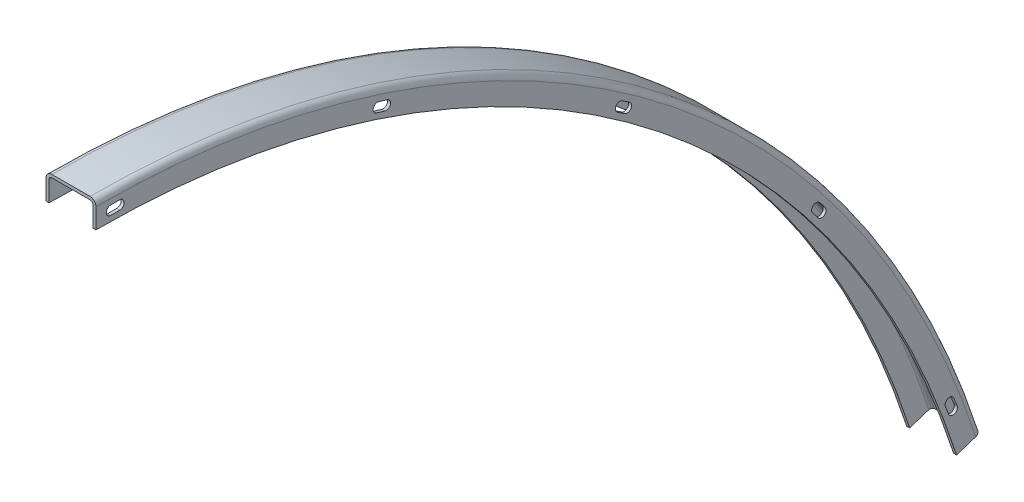
from build123d import *

# Parameters (mm, degrees)
REVOLVE1_ANGLE     = 72
CUT_EXTRUDE1_DEPTH = 10


with BuildPart() as part:
    # Sketch1 → Revolve1 (revolve)
    with BuildSketch(Plane.XY):
        with BuildLine():
            ThreePointArc((-52.157480315, 97.330708661), (-49.814334564, 102.987562911), (-44.157480315, 105.330708661))
            Line((-44.157480315, 105.330708661), (6.842519685, 105.330708661))
            ThreePointArc((6.842519685, 105.330708661), (12.499373935, 102.987562911), (14.842519685, 97.330708661))
            Line((14.842519685, 97.330708661), (14.842519685, 70.330708661))
            Line((14.842519685, 70.330708661), (10.842519685, 70.330708661))
            Line((10.842519685, 70.330708661), (10.842519685, 97.330708661))
            ThreePointArc((10.842519685, 97.330708661), (9.67094681, 100.159135786), (6.842519685, 101.330708661))
            Line((6.842519685, 101.330708661), (-44.157480315, 101.330708661))
            ThreePointArc((-44.157480315, 101.330708661), (-46.98590744, 100.159135786), (-48.157480315, 97.330708661))
            Line((-48.157480315, 97.330708661), (-48.157480315, 70.330708661))
            Line((-48.157480315, 70.330708661), (-52.157480315, 70.330708661))
            Line((-52.157480315, 70.330708661), (-52.157480315, 97.330708661))
        make_face()
    revolve(axis=Axis((14.842519685, -1144.669291339, 0), (-1, 0, 0)), revolution_arc=REVOLVE1_ANGLE)

    # Sketch2 → Cut-Extrude1 (cut)
    with BuildSketch(Plane(origin=(14.842519685, 0, 0), x_dir=(0, 0, -1), z_dir=(1, 0, 0))):
        with BuildLine():
            Line((20, 89.330708661), (32, 89.330708661))
            ThreePointArc((32, 89.330708661), (38, 83.330708661), (32, 77.330708661))
            Line((32, 77.330708661), (20, 77.330708661))
            ThreePointArc((20, 77.330708661), (14, 83.330708661), (20, 89.330708661))
        make_face()
        with BuildLine():
            Line((379.912778747, 29.563343425), (391.388435819, 26.054882969))
            ThreePointArc((391.388435819, 26.054882969), (395.372034126, 18.562824205), (387.879975362, 14.579225897))
            Line((387.879975362, 14.579225897), (376.40431829, 18.087686354))
            ThreePointArc((376.40431829, 18.087686354), (372.420719983, 25.579745118), (379.912778747, 29.563343425))
        make_face()
        with BuildLine():
            Line((706.624794334, -132.820784875), (716.573245205, -139.531099717))
            ThreePointArc((716.573245205, -139.531099717), (718.192313219, -147.860482573), (709.862930363, -149.479550587))
            Line((709.862930363, -149.479550587), (699.914479492, -142.769235746))
            ThreePointArc((699.914479492, -142.769235746), (698.295411478, -134.43985289), (706.624794334, -132.820784875))
        make_face()
        with BuildLine():
            Line((971.584524259, -383.630848012), (979.136368952, -392.95659955))
            ThreePointArc((979.136368952, -392.95659955), (978.249415529, -401.395397665), (969.810617414, -400.508444242))
            Line((969.810617414, -400.508444242), (962.258772721, -391.182692705))
            ThreePointArc((962.258772721, -391.182692705), (963.145726144, -382.74389459), (971.584524259, -383.630848012))
        make_face()
        with BuildLine():
            Line((1151.637008404, -700.948432155), (1156.132287525, -712.074638409))
            ThreePointArc((1156.132287525, -712.074638409), (1152.816823958, -719.885381097), (1145.00608127, -716.56991753))
            Line((1145.00608127, -716.56991753), (1140.510802149, -705.443711276))
            ThreePointArc((1140.510802149, -705.443711276), (1143.826265716, -697.632968588), (1151.637008404, -700.948432155))
        make_face()
    extrude(amount=-CUT_EXTRUDE1_DEPTH, mode=Mode.SUBTRACT)


solid = part.part
